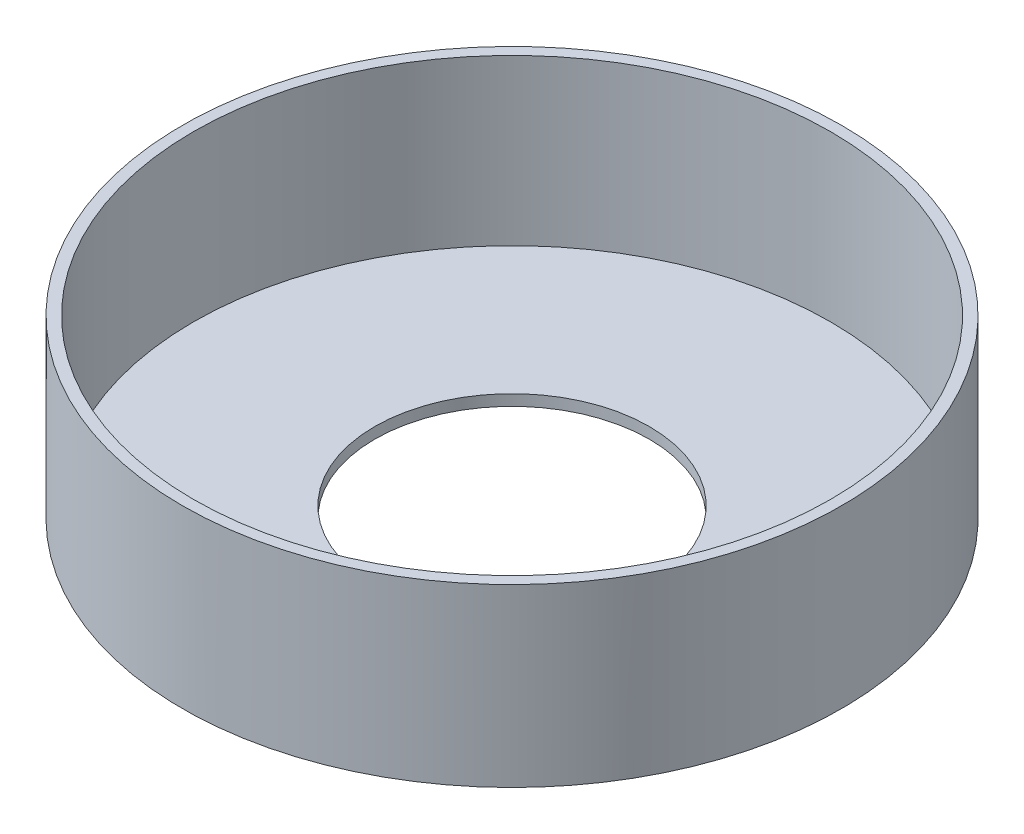
from build123d import *

# Parameters (mm, degrees)
SKETCH1_R           = 30
SKETCH1_R_2         = 29
BOSS_EXTRUDE1_DEPTH = 15
BOSS_EXTRUDE2_START = 1
SKETCH2_R           = 30
SKETCH2_R_2         = 12.5
BOSS_EXTRUDE2_DEPTH = 1


with BuildPart() as part:
    # Sketch1 → Boss-Extrude1 (new body)
    with BuildSketch(Plane(origin=(0, 0, 0), x_dir=(1, 0, 0), z_dir=(0, 1, 0))):
        with Locations(Location((0, 0, 0), (0, 0, 270))):
            Circle(SKETCH1_R)
        with Locations(Location((0, 0, 0), (0, 0, 270))):
            Circle(SKETCH1_R_2, mode=Mode.SUBTRACT)
    extrude(amount=BOSS_EXTRUDE1_DEPTH)

    # Sketch2 → Boss-Extrude2 (add)
    with BuildSketch(Plane.XZ.offset(BOSS_EXTRUDE2_START)):
        with Locations(Location((0, 0, 0), (0, 0, 270))):
            Circle(SKETCH2_R)
        with Locations(Location((0, 0, 0), (0, 0, 270))):
            Circle(SKETCH2_R_2, mode=Mode.SUBTRACT)
    extrude(amount=-BOSS_EXTRUDE2_DEPTH)


solid = part.part
